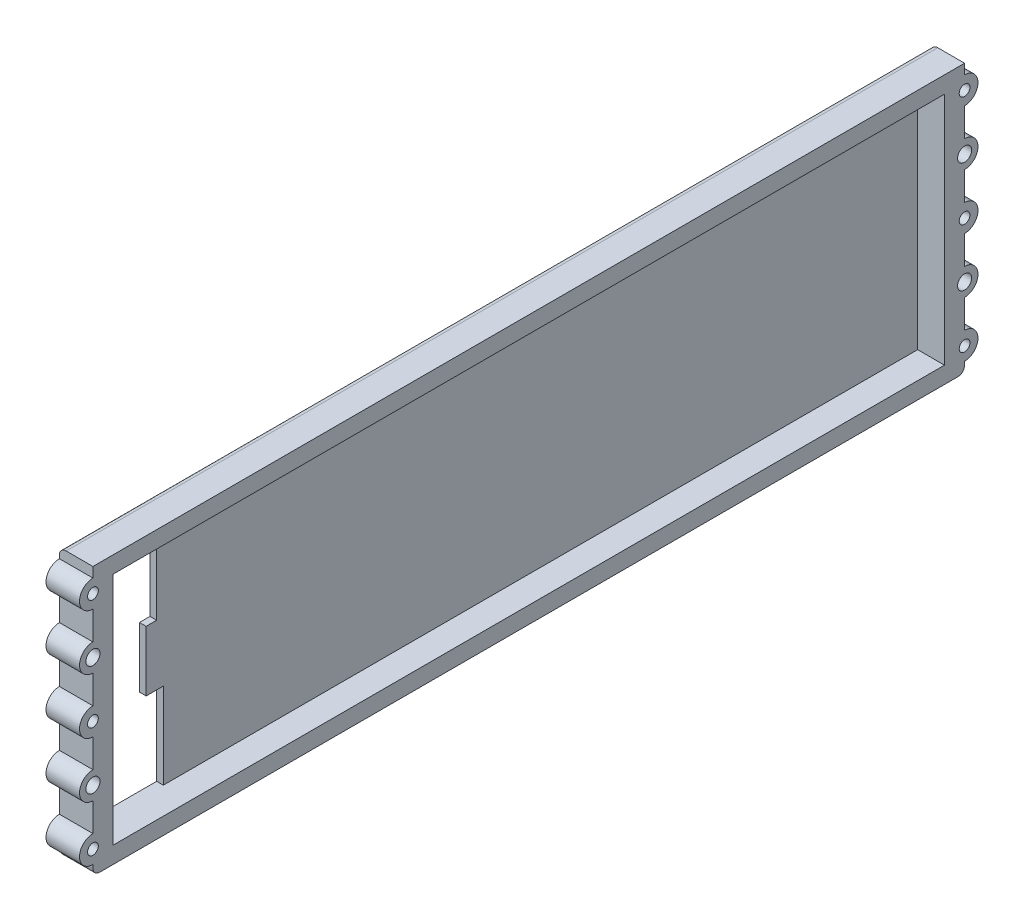
from build123d import *

# Parameters (mm, degrees)
SKETCH_1_W               = 126
SKETCH_1_H               = 37
SKETCH_1_W_2             = 124
SKETCH_1_H_2             = 35
EXTRUDE_1_DEPTH          = 6
SKETCH_2_W               = 126
SKETCH_2_H               = 37
EXTRUDE_2_DEPTH          = 1
SKETCH_3_W               = 6
SKETCH_3_H               = 37
EXTRUDE_3_DEPTH          = 2
SKETCH_4_W               = 6
SKETCH_4_H               = 37
EXTRUDE_4_DEPTH          = 2
SKETCH_10_R              = 2
EXTRUDE_6_DEPTH          = 6
PATTERN_LINEAR_1_COUNT   = 5
PATTERN_LINEAR_1_PITCH   = 8.25
MIRROR_2_COPY_1_SKETCH_R = 2
MIRROR_2_COPY_1_DEPTH    = 6
MIRROR_2_COPY_2_SKETCH_R = 2
MIRROR_2_COPY_2_DEPTH    = 6
MIRROR_2_COPY_3_SKETCH_R = 2
MIRROR_2_COPY_3_DEPTH    = 6
MIRROR_2_COPY_4_SKETCH_R = 2
MIRROR_2_COPY_4_DEPTH    = 6
SKETCH_13_R              = 0.8
CUT_EXTRUDE_4_DEPTH      = 70.765679241
SKETCH_14_R              = 2
CUT_EXTRUDE_5_DEPTH      = 1.5
SKETCH_15_R              = 1.05
CUT_EXTRUDE_6_DEPTH      = 70.652709926
CUT_EXTRUDE_7_DEPTH      = 10
SKETCH_18_W              = 185.055300519
SKETCH_18_H              = 78.031908054
CUT_EXTRUDE_8_DEPTH      = 1
SKETCH_19_W              = 5
SKETCH_19_H              = 130
EXTRUDE_7_DEPTH          = 1.5
SKETCH_20_W              = 5
SKETCH_20_H              = 130
EXTRUDE_8_DEPTH          = 1.5
SKETCH_21_W              = 9.5
SKETCH_21_H              = 12.2
CUT_EXTRUDE_9_DEPTH      = 10
FILLET_1_R               = 1
CUT_EXTRUDE_10_DEPTH     = 10
EXTRUDE_START            = 1.5
SKETCH_23_R              = 1.05
EXTRUDE_9_DEPTH          = 1.5


with BuildPart() as part:
    # 草图1 → 凸台-拉伸1 (new body)
    with BuildSketch(Plane(origin=(0, 0, 0), x_dir=(0, 0, -1), z_dir=(1, 0, 0))):
        Rectangle(SKETCH_1_W, SKETCH_1_H)
        Rectangle(SKETCH_1_W_2, SKETCH_1_H_2, mode=Mode.SUBTRACT)
    extrude(amount=EXTRUDE_1_DEPTH)

    # 草图2 → 凸台-拉伸2 (add)
    with BuildSketch(Plane.ZY):
        Rectangle(SKETCH_2_W, SKETCH_2_H)
    extrude(amount=-EXTRUDE_2_DEPTH)

    # 草图3 → 凸台-拉伸3 (add)
    with BuildSketch(Plane(origin=(0, 0, -63), x_dir=(-1, 0, 0), z_dir=(0, 0, -1))):
        with Locations((-3, 0)):
            Rectangle(SKETCH_3_W, SKETCH_3_H)
    extrude(amount=EXTRUDE_3_DEPTH)

    # 草图4 → 凸台-拉伸4 (add)
    with BuildSketch(Plane.XY.offset(63)):
        with Locations((3, 0)):
            Rectangle(SKETCH_4_W, SKETCH_4_H)
    extrude(amount=EXTRUDE_4_DEPTH)

    # 草图10 → 凸台-拉伸6 (add)
    with BuildSketch(Plane.ZY):
        with Locations((-65, -16.5)):
            Circle(SKETCH_10_R)
    extrude_6 = extrude(amount=-EXTRUDE_6_DEPTH)

    # 阵列(线性)1: 凸台-拉伸6 ×5
    with Locations(*[(0, i * PATTERN_LINEAR_1_PITCH, 0) for i in range(1, PATTERN_LINEAR_1_COUNT)]):
        add(extrude_6)

    # 镜向2: 凸台-拉伸6 across plane
    add(extrude_6.mirror(Plane.XY))

    # 镜向2 copy 1 sketch → 镜向2 copy 1 (add)
    with BuildSketch(Plane(origin=(0, 8.25, 0), x_dir=(0, 0, -1), z_dir=(-1, 0, 0))):
        with Locations((-65, 16.5)):
            Circle(MIRROR_2_COPY_1_SKETCH_R)
    extrude(amount=-MIRROR_2_COPY_1_DEPTH)

    # 镜向2 copy 2 sketch → 镜向2 copy 2 (add)
    with BuildSketch(Plane(origin=(0, 16.5, 0), x_dir=(0, 0, -1), z_dir=(-1, 0, 0))):
        with Locations((-65, 16.5)):
            Circle(MIRROR_2_COPY_2_SKETCH_R)
    extrude(amount=-MIRROR_2_COPY_2_DEPTH)

    # 镜向2 copy 3 sketch → 镜向2 copy 3 (add)
    with BuildSketch(Plane(origin=(0, 24.75, 0), x_dir=(0, 0, -1), z_dir=(-1, 0, 0))):
        with Locations((-65, 16.5)):
            Circle(MIRROR_2_COPY_3_SKETCH_R)
    extrude(amount=-MIRROR_2_COPY_3_DEPTH)

    # 镜向2 copy 4 sketch → 镜向2 copy 4 (add)
    with BuildSketch(Plane(origin=(0, 33, 0), x_dir=(0, 0, -1), z_dir=(-1, 0, 0))):
        with Locations((-65, 16.5)):
            Circle(MIRROR_2_COPY_4_SKETCH_R)
    extrude(amount=-MIRROR_2_COPY_4_DEPTH)

    # 草图13 → 切除-拉伸4 (cut, through all)
    with BuildSketch(Plane.ZY):
        with Locations((65, -16.5)):
            Circle(SKETCH_13_R)
        with Locations((65, 0)):
            Circle(SKETCH_13_R)
        with Locations((65, 16.5)):
            Circle(SKETCH_13_R)
    cut_extrude_4 = extrude(amount=-CUT_EXTRUDE_4_DEPTH, mode=Mode.SUBTRACT)

    # 草图14 → 切除-拉伸5 (cut)
    with BuildSketch(Plane.ZY):
        with Locations((65, -8.25)):
            Circle(SKETCH_14_R)
        with Locations((65, 8.25)):
            Circle(SKETCH_14_R)
    cut_extrude_5 = extrude(amount=-CUT_EXTRUDE_5_DEPTH, mode=Mode.SUBTRACT)

    # 草图15 → 切除-拉伸6 (cut, through all)
    with BuildSketch(Plane.ZY.offset(-1.5)):
        with Locations((65, -8.25)):
            Circle(SKETCH_15_R)
        with Locations((65, 8.25)):
            Circle(SKETCH_15_R)
    cut_extrude_6 = extrude(amount=-CUT_EXTRUDE_6_DEPTH, mode=Mode.SUBTRACT)

    # 镜向3: 切除-拉伸4, 切除-拉伸5, 切除-拉伸6 across plane
    add(cut_extrude_4.mirror(Plane.XY), mode=Mode.SUBTRACT)
    add(cut_extrude_5.mirror(Plane.XY), mode=Mode.SUBTRACT)
    add(cut_extrude_6.mirror(Plane.XY), mode=Mode.SUBTRACT)

    # 草图16 → 切除-拉伸7 (cut)
    with BuildSketch(Plane(origin=(1, 0, 0), x_dir=(0, 0, -1), z_dir=(1, 0, 0))):
        Polygon((-53.561328166, 17), (-61.5, 17), (-61.5, -17), (-53.561328166, -17), (-53.561328166, -9), (-53.561328166, -8), (-53.561328166, -5.2), align=None)
        Polygon((-51, -5.2), (-53.561328166, -5.2), (-53.561328166, -8), (-53.561328166, -9), (-53.561328166, -17), (-51, -17), align=None)
    extrude(amount=-CUT_EXTRUDE_7_DEPTH, mode=Mode.SUBTRACT)

    # 草图18 → 切除-拉伸8 (cut)
    with BuildSketch(Plane(origin=(6, 0, 0), x_dir=(0, 0, -1), z_dir=(1, 0, 0))):
        with Locations((-2.452376317, 2.737795631)):
            Rectangle(SKETCH_18_W, SKETCH_18_H)
    extrude(amount=-CUT_EXTRUDE_8_DEPTH, mode=Mode.SUBTRACT)

    # 草图19 → 凸台-拉伸7 (add)
    with BuildSketch(Plane(origin=(0, 18.5, 0), x_dir=(1, 0, 0), z_dir=(0, 1, 0))):
        with Locations((2.5, 0)):
            Rectangle(SKETCH_19_W, SKETCH_19_H)
    extrude(amount=EXTRUDE_7_DEPTH)

    # 草图20 → 凸台-拉伸8 (add)
    with BuildSketch(Plane.XZ.offset(18.5)):
        with Locations((2.5, 0)):
            Rectangle(SKETCH_20_W, SKETCH_20_H)
    extrude(amount=EXTRUDE_8_DEPTH)

    # 草图21 → 切除-拉伸9 (cut)
    with BuildSketch(Plane.ZY):
        with Locations((56.75, 10.9)):
            Rectangle(SKETCH_21_W, SKETCH_21_H)
    extrude(amount=-CUT_EXTRUDE_9_DEPTH, mode=Mode.SUBTRACT)

    # 圆角1
    fillet_1_edges = [part.edges().sort_by_distance(p)[0] for p in [
        (0, 20, 0),
        (2.5, -20, -65),
        (2.5, -20, 65),
        (0, -20, 0),
    ]]
    fillet(fillet_1_edges, radius=FILLET_1_R)

    # 草图22 → 切除-拉伸10 (cut)
    with BuildSketch(Plane(origin=(1, 0, 0), x_dir=(0, 0, -1), z_dir=(1, 0, 0))):
        Polygon((-62, 17.5), (-62, -17.5), (-50.5, -17.5), (-50.5, -4.7), (-53.061328166, -4.7), (-53.061328166, 4.3), (-51.5, 4.3), (-51.5, 17.5), align=None)
        Polygon((-61.5, -17), (-51, -17), (-51, -5.2), (-53.561328166, -5.2), (-53.561328166, 4.8), (-52, 4.8), (-52, 17), (-61.5, 17), align=None, mode=Mode.SUBTRACT)
    extrude(amount=-CUT_EXTRUDE_10_DEPTH, mode=Mode.SUBTRACT)

    # 草图23 → 凸台-拉伸9 (add)
    # profile 1 of 4: a face of its own
    with BuildSketch(Plane.ZY.offset(-1.5).offset(EXTRUDE_START)):
        with BuildLine():
            ThreePointArc((65, 10.25), (63, 8.25), (65, 6.25))
            ThreePointArc((65, 6.25), (67, 8.25), (65, 10.25))
        make_face()
        with Locations(Location((65, 8.25, 0), (0, 0, 180))):
            Circle(SKETCH_23_R, mode=Mode.SUBTRACT)
    # profile 2 of 4: a face of its own
    with BuildSketch(Plane.ZY.offset(-1.5).offset(EXTRUDE_START)):
        with BuildLine():
            ThreePointArc((65, -6.25), (63, -8.25), (65, -10.25))
            ThreePointArc((65, -10.25), (67, -8.25), (65, -6.25))
        make_face()
        with Locations(Location((65, -8.25, 0), (0, 0, 180))):
            Circle(SKETCH_23_R, mode=Mode.SUBTRACT)
    # profile 3 of 4: a face of its own
    with BuildSketch(Plane.ZY.offset(-1.5).offset(EXTRUDE_START)):
        with BuildLine():
            ThreePointArc((-65, -10.25), (-63, -8.25), (-65, -6.25))
            ThreePointArc((-65, -6.25), (-67, -8.25), (-65, -10.25))
        make_face()
        with Locations(Location((-65, -8.25, 0), (0, 0, 180))):
            Circle(SKETCH_23_R, mode=Mode.SUBTRACT)
    # profile 4 of 4: a face of its own
    with BuildSketch(Plane.ZY.offset(-1.5).offset(EXTRUDE_START)):
        with BuildLine():
            ThreePointArc((-65, 6.25), (-63, 8.25), (-65, 10.25))
            ThreePointArc((-65, 10.25), (-67, 8.25), (-65, 6.25))
        make_face()
        with Locations(Location((-65, 8.25, 0), (0, 0, 180))):
            Circle(SKETCH_23_R, mode=Mode.SUBTRACT)
    extrude(amount=-EXTRUDE_9_DEPTH)


solid = part.part
